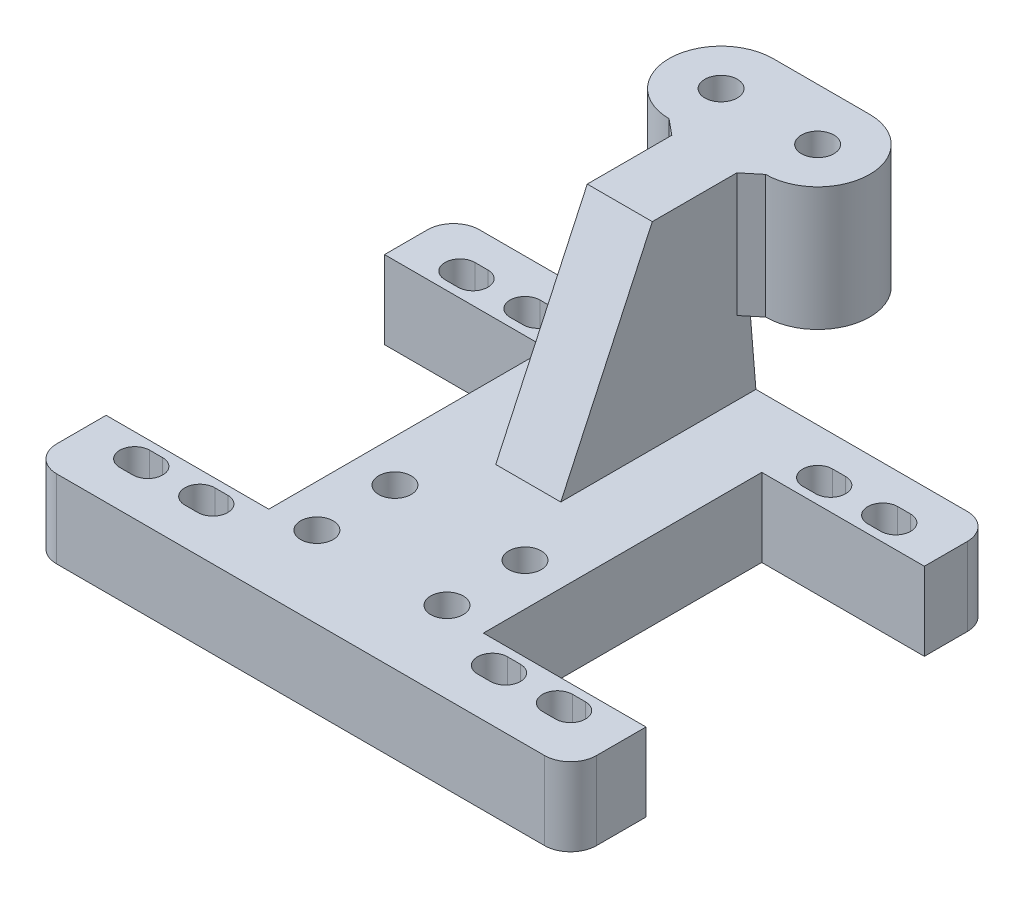
from build123d import *

# Parameters (mm, degrees)
BOSS_EXTRU_1_DEPTH      = 12
ESQUISSE6_R             = 2.5
BOSS_EXTRU_2_DEPTH      = 9.5
BOSS_EXTRU_3_DEPTH      = 5
CONG_1_R                = 4
ESQUISSE8_R             = 2.5
ENL_V_MAT_EXTRU_1_DEPTH = 125.49859437
BOSS_EXTRU_4_DEPTH      = 19


with BuildPart() as part:
    # Esquisse1 → Boss.-Extru.1 (new body)
    with BuildSketch(Plane.XZ.offset(-8.7)):
        Polygon((38.5, 59), (41.5, 59), (41.5, 48.4), (0, 48.4), (0, 113.4), (41.5, 113.4), (41.5, 101.8), (38.5, 101.8), (16.5, 101.8), (16.5, 59), align=None)
        with BuildLine():
            Line((21.5, 57.7), (23.5, 57.7))
            ThreePointArc((23.5, 57.7), (25.8, 55.4), (23.5, 53.1))
            Line((23.5, 53.1), (21.5, 53.1))
            ThreePointArc((21.5, 53.1), (19.2, 55.4), (21.5, 57.7))
        make_face(mode=Mode.SUBTRACT)
        with BuildLine():
            Line((31.5, 57.7), (33.5, 57.7))
            ThreePointArc((33.5, 57.7), (35.8, 55.4), (33.5, 53.1))
            Line((33.5, 53.1), (31.5, 53.1))
            ThreePointArc((31.5, 53.1), (29.2, 55.4), (31.5, 57.7))
        make_face(mode=Mode.SUBTRACT)
        with BuildLine():
            Line((21.5, 107.7), (23.5, 107.7))
            ThreePointArc((23.5, 107.7), (25.8, 105.4), (23.5, 103.1))
            Line((23.5, 103.1), (21.5, 103.1))
            ThreePointArc((21.5, 103.1), (19.2, 105.4), (21.5, 107.7))
        make_face(mode=Mode.SUBTRACT)
        with BuildLine():
            Line((31.5, 107.7), (33.5, 107.7))
            ThreePointArc((33.5, 107.7), (35.8, 105.4), (33.5, 103.1))
            Line((33.5, 103.1), (31.5, 103.1))
            ThreePointArc((31.5, 103.1), (29.2, 105.4), (31.5, 107.7))
        make_face(mode=Mode.SUBTRACT)
    boss_extru_1 = extrude(amount=BOSS_EXTRU_1_DEPTH)

    # Symétrie1: Boss.-Extru.1 across plane
    add(boss_extru_1.mirror(Plane(origin=(0, 0, 0), x_dir=(0, 0, 1), z_dir=(1, 0, 0))))



with BuildPart() as body_2:
    # Esquisse6 → Boss.-Extru.2 (new, symmetric)
    with BuildSketch(Plane(origin=(0, 29.5, 0), x_dir=(1, 0, 0), z_dir=(0, 1, 0))):
        with BuildLine():
            Line((-7.424824728, -33.32967845), (7.424824728, -33.32967845))
            ThreePointArc((7.424824728, -33.32967845), (15.424824728, -41.32967845), (7.424824728, -49.32967845))
            Line((7.424824728, -49.32967845), (-7.424824728, -49.32967845))
            ThreePointArc((-7.424824728, -49.32967845), (-15.424824728, -41.32967845), (-7.424824728, -33.32967845))
        make_face()
        with Locations(Location((7.424824728, -41.32967845, 0), (0, 0, 270))):
            Circle(ESQUISSE6_R, mode=Mode.SUBTRACT)
        with Locations(Location((-7.424824728, -41.32967845, 0), (0, 0, 90))):
            Circle(ESQUISSE6_R, mode=Mode.SUBTRACT)
    extrude(amount=BOSS_EXTRU_2_DEPTH, both=True)


with BuildPart() as part_1:
    add(part.part)

    add(body_2.part)  # Boss.-Extru.3 merges body 2
    # Esquisse7 → Boss.-Extru.3 (add, symmetric)
    with BuildSketch(Plane(origin=(0, 0, 0), x_dir=(0, 0, -1), z_dir=(1, 0, 0))):
        Polygon((-49.32967845, 20), (-49.32967845, 39), (-64.32967845, 39), (-78.4, 8.7), (-48.4, 8.7), align=None)
    extrude(amount=BOSS_EXTRU_3_DEPTH, both=True)

    # Congé1
    cong_1_edges = [part_1.edges().sort_by_distance(p)[0] for p in [
        (41.5, 2.7, 48.4),
        (41.5, 2.7, 113.4),
        (-41.5, 2.7, 48.4),
        (-41.5, 2.7, 113.4),
    ]]
    fillet(cong_1_edges, radius=CONG_1_R)

    # Esquisse8 → Enlèv. mat.-Extru.1 (cut, through all)
    with BuildSketch(Plane(origin=(0, 8.7, 0), x_dir=(1, 0, 0), z_dir=(0, 1, 0))):
        with Locations(Location((-10, -88.9, 0), (0, 0, 180))):
            Circle(ESQUISSE8_R)
        with Locations(Location((-10, -100.9, 0), (0, 0, 180))):
            Circle(ESQUISSE8_R)
        with Locations(Location((10, -100.9, 0), (0, 0, 180))):
            Circle(ESQUISSE8_R)
        with Locations(Location((10, -88.9, 0), (0, 0, 180))):
            Circle(ESQUISSE8_R)
    extrude(amount=-ENL_V_MAT_EXTRU_1_DEPTH, mode=Mode.SUBTRACT)

    # Esquisse9 → Boss.-Extru.4 (add)
    with BuildSketch(Plane(origin=(0, 39, 0), x_dir=(1, 0, 0), z_dir=(0, 1, 0))):
        Polygon((-7.424824728, -49.32967845), (-5, -51.32967845), (-5, -49.32967845), align=None)
        Polygon((5, -51.32967845), (5, -49.32967845), (7.424824728, -49.32967845), align=None)
    extrude(amount=-BOSS_EXTRU_4_DEPTH)


solid = part_1.part
